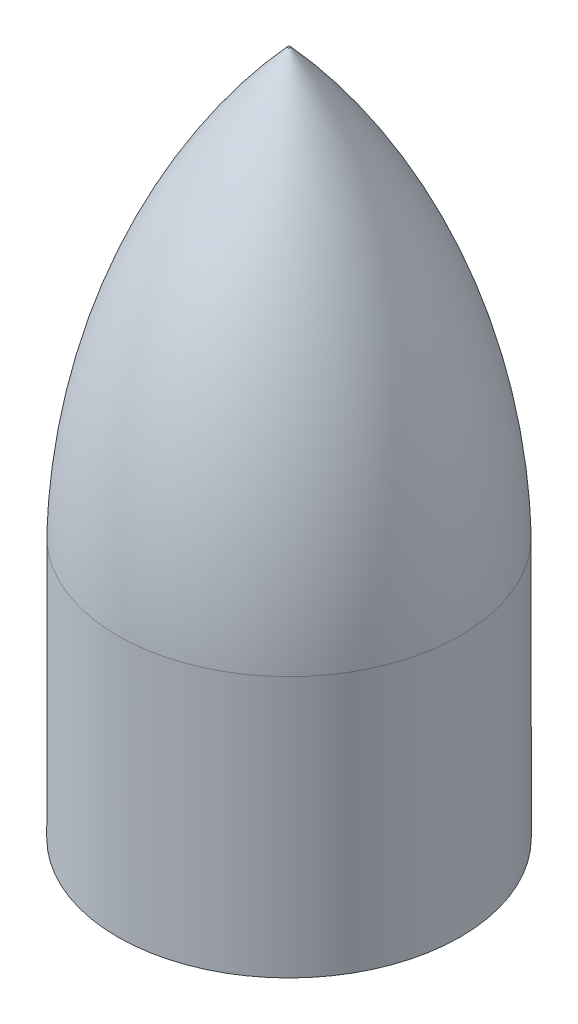
from build123d import *

# Parameters (mm, degrees)
SKETCH1_R           = 1.5
BOSS_EXTRUDE1_DEPTH = 6


with BuildPart() as part:
    # Sketch1 → Boss-Extrude1 (new body)
    with BuildSketch(Plane(origin=(0, 0, 0), x_dir=(1, 0, 0), z_dir=(0, 1, 0))):
        with Locations(Location((0, 0, 0), (0, 0, 270))):
            Circle(SKETCH1_R)
    extrude(amount=BOSS_EXTRUDE1_DEPTH)

    # Sketch2 → Cut-Revolve2 (revolve, cut)
    with BuildSketch(Plane.XY):
        with BuildLine():
            Line((1.5, 2), (1.669062556, 2))
            Line((1.669062556, 2), (1.669062556, 6.084715674))
            Line((1.669062556, 6.084715674), (0.01, 6.084715674))
            Line((0.01, 6.084715674), (0.01, 6))
            ThreePointArc((0.01, 6), (1.141151028, 4.143841258), (1.5, 2))
        make_face()
    revolve(axis=Axis((0, 6, 0), (0, -1, 0)), mode=Mode.SUBTRACT)


solid = part.part
